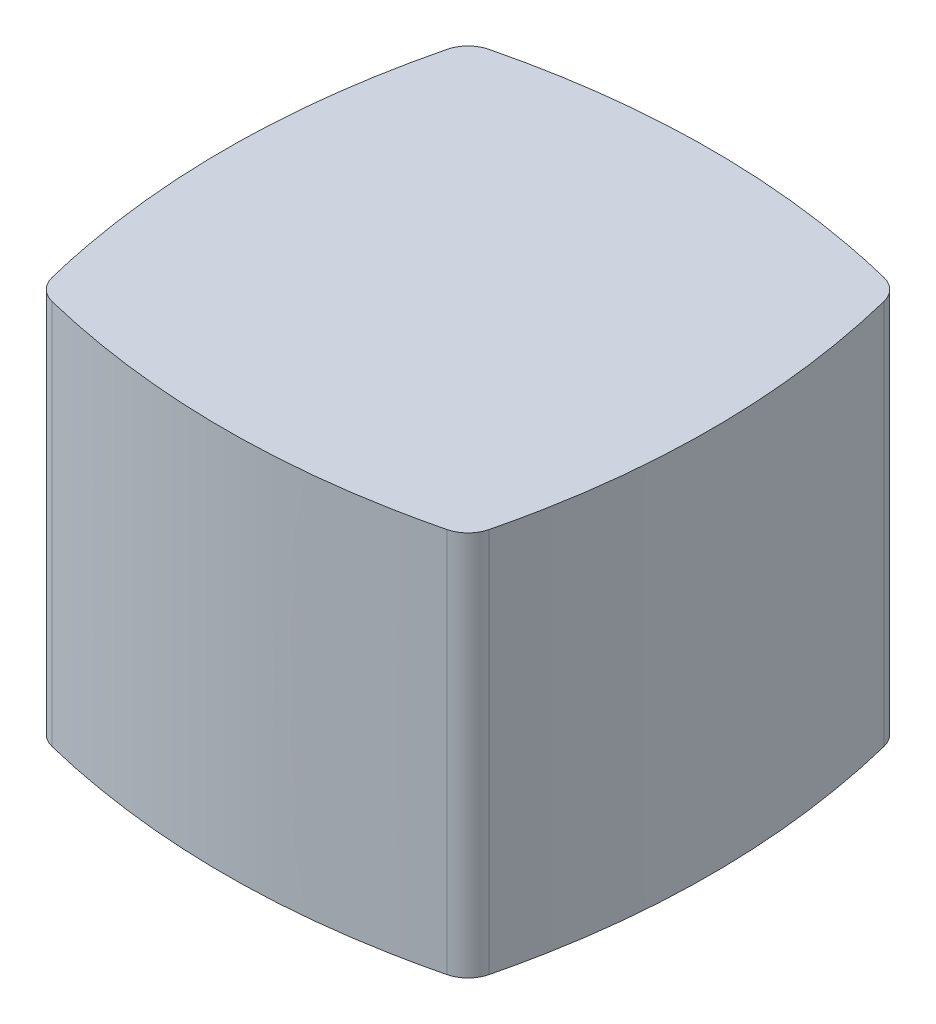
from build123d import *

# Parameters (mm, degrees)
BOSS_EXTRUDE1_DEPTH      = 42.8625
FILLET1_R                = 3.175
SHELL1_T                 = -2.54
SHELL1_THICKNESS_2_DEPTH = 22.86


with BuildPart() as part:
    # Sketch1 → Boss-Extrude1 (new body)
    with BuildSketch(Plane(origin=(0, 0, 0), x_dir=(1, 0, 0), z_dir=(0, 1, 0))):
        with BuildLine():
            Line((0, 0), (-26.9875, 0))
            add(Edge.make_bspline(
                [(-26.9875, 0), (-26.9875, -11.90625), (-23.8125, -23.8125)],
                knots=[0.5, 0.5, 0.5, 1, 1, 1], degree=2))
            add(Edge.make_bspline(
                [(-23.8125, -23.8125), (-11.90625, -26.9875), (0, -26.9875)],
                knots=[0, 0, 0, 0.5, 0.5, 0.5], degree=2))
            Line((0, -26.9875), (0, 0))
        make_face()
        with BuildLine():
            add(Edge.make_bspline(
                [(-23.8125, 23.8125), (-26.9875, 11.90625), (-26.9875, 0)],
                knots=[0, 0, 0, 0.5, 0.5, 0.5], degree=2))
            Line((-26.9875, 0), (0, 0))
            Line((0, 0), (0, 26.9875))
            add(Edge.make_bspline(
                [(-23.8125, 23.8125), (-11.90625, 26.9875), (0, 26.9875)],
                knots=[0, 0, 0, 0.5, 0.5, 0.5], degree=2))
        make_face()
        with BuildLine():
            Line((0, 26.9875), (0, 0))
            Line((0, 0), (26.9875, 0))
            add(Edge.make_bspline(
                [(23.8125, 23.8125), (26.9875, 11.90625), (26.9875, 0)],
                knots=[0, 0, 0, 0.5, 0.5, 0.5], degree=2))
            add(Edge.make_bspline(
                [(0, 26.9875), (11.90625, 26.9875), (23.8125, 23.8125)],
                knots=[0.5, 0.5, 0.5, 1, 1, 1], degree=2))
        make_face()
        with BuildLine():
            Line((26.9875, 0), (0, 0))
            Line((0, 0), (0, -26.9875))
            add(Edge.make_bspline(
                [(0, -26.9875), (11.90625, -26.9875), (23.8125, -23.8125)],
                knots=[0.5, 0.5, 0.5, 1, 1, 1], degree=2))
            add(Edge.make_bspline(
                [(26.9875, 0), (26.9875, -11.90625), (23.8125, -23.8125)],
                knots=[0.5, 0.5, 0.5, 1, 1, 1], degree=2))
        make_face()
    extrude(amount=BOSS_EXTRUDE1_DEPTH)

    # Fillet1
    fillet1_edges = [part.edges().sort_by_distance(p)[0] for p in [
        (-23.8125, 21.43125, -23.8125),
        (23.8125, 21.43125, -23.8125),
        (-23.8125, 21.43125, 23.8125),
        (23.8125, 21.43125, 23.8125),
    ]]
    fillet(fillet1_edges, radius=FILLET1_R)

    # Shell1
    shell1_openings = [part.faces().sort_by_distance(p)[0] for p in [
        (0, 0, 0),
    ]]
    offset(amount=SHELL1_T, openings=shell1_openings, kind=Kind.INTERSECTION)

    # Shell1 thickness 2 face (on inner face of the shell) → Shell1 thickness 2 (add)
    with BuildSketch(Plane.ZX.offset(40.3225)):
        with BuildLine():
            add(Edge.make_bspline(
                [(0, 24.4475), (-1.071869465, 24.4475), (-2.143739556, 24.43094642), (-3.215267754, 24.397839525), (-4.286115818, 24.348222087), (-6.421610358, 24.216394318), (-7.486265887, 24.134311515), (-8.54958659, 24.036015719), (-9.611254694, 23.921630019), (-11.743539395, 23.659419619), (-12.814109125, 23.511205126), (-13.88235706, 23.3468401), (-14.947985708, 23.166525864), (-17.086124997, 22.772130343), (-18.158566925, 22.557671393), (-19.22775412, 22.327362372), (-20.293423551, 22.08147565), (-21.35533565, 21.820305652)],
                knots=[0, 0, 0, 0, 0, 0, 0.248477459, 0.248477459, 0.248477459, 0.248477459, 0.495985618, 0.495985618, 0.495985618, 0.495985618, 0.74649861, 0.74649861, 0.74649861, 0.74649861, 1, 1, 1, 1, 1, 1], degree=5))
            add(Edge.make_bspline(
                [(21.35533565, 21.820305652), (20.289203718, 22.082513489), (19.219284528, 22.329316344), (18.145820526, 22.560416266), (17.069077982, 22.775537715), (14.930844986, 23.169424637), (13.869469996, 23.348822158), (12.805499117, 23.51239687), (11.739226346, 23.659950002), (9.607010403, 23.922151946), (8.541082283, 24.03693173), (7.47348954, 24.135491809), (6.404553827, 24.217707768), (4.269027068, 24.349012308), (3.202443079, 24.398234977), (2.135187053, 24.431078239), (1.067593219, 24.4475), (0, 24.4475)],
                knots=[0, 0, 0, 0, 0, 0, 0.254508755, 0.254508755, 0.254508755, 0.254508755, 0.504014382, 0.504014382, 0.504014382, 0.504014382, 0.752513847, 0.752513847, 0.752513847, 0.752513847, 1, 1, 1, 1, 1, 1], degree=5))
            add(Edge.make_bspline(
                [(21.820305652, 21.35533565), (21.812453385, 21.387262812), (21.802393097, 21.419258118), (21.790035363, 21.451038976), (21.77536128, 21.48227591), (21.74153415, 21.543014881), (21.722381106, 21.572517054), (21.701063345, 21.600828441), (21.677752563, 21.627635172), (21.627635172, 21.677752563), (21.600828441, 21.701063345), (21.572517054, 21.722381106), (21.543014881, 21.74153415), (21.48227591, 21.77536128), (21.451038976, 21.790035363), (21.419258118, 21.802393097), (21.387262812, 21.812453385), (21.35533565, 21.820305652)],
                knots=[0, 0, 0, 0, 0, 0, 0.249998778, 0.249998778, 0.249998778, 0.249998778, 0.5, 0.5, 0.5, 0.5, 0.750001222, 0.750001222, 0.750001222, 0.750001222, 1, 1, 1, 1, 1, 1], degree=5))
            add(Edge.make_bspline(
                [(21.820305652, 21.35533565), (22.082513489, 20.289203718), (22.329316344, 19.219284528), (22.560416266, 18.145820526), (22.775537715, 17.069077982), (23.169424637, 14.930844986), (23.348822158, 13.869469996), (23.51239687, 12.805499117), (23.659950002, 11.739226346), (23.922151946, 9.607010403), (24.03693173, 8.541082283), (24.135491809, 7.47348954), (24.217707768, 6.404553827), (24.349012308, 4.269027068), (24.398234977, 3.202443079), (24.431078239, 2.135187053), (24.4475, 1.067593219), (24.4475, 0)],
                knots=[0, 0, 0, 0, 0, 0, 0.254508755, 0.254508755, 0.254508755, 0.254508755, 0.504014382, 0.504014382, 0.504014382, 0.504014382, 0.752513847, 0.752513847, 0.752513847, 0.752513847, 1, 1, 1, 1, 1, 1], degree=5))
            add(Edge.make_bspline(
                [(24.4475, 0), (24.4475, -1.071869465), (24.43094642, -2.143739556), (24.397839525, -3.215267754), (24.348222087, -4.286115818), (24.216394318, -6.421610358), (24.134311515, -7.486265887), (24.036015719, -8.54958659), (23.921630019, -9.611254694), (23.659419619, -11.743539395), (23.511205126, -12.814109125), (23.3468401, -13.88235706), (23.166525864, -14.947985708), (22.772130343, -17.086124997), (22.557671393, -18.158566925), (22.327362372, -19.22775412), (22.08147565, -20.293423551), (21.820305652, -21.35533565)],
                knots=[0, 0, 0, 0, 0, 0, 0.248477459, 0.248477459, 0.248477459, 0.248477459, 0.495985618, 0.495985618, 0.495985618, 0.495985618, 0.74649861, 0.74649861, 0.74649861, 0.74649861, 1, 1, 1, 1, 1, 1], degree=5))
            add(Edge.make_bspline(
                [(21.820305652, -21.35533565), (21.812453385, -21.387262812), (21.802393097, -21.419258118), (21.790035363, -21.451038976), (21.77536128, -21.48227591), (21.74153415, -21.543014881), (21.722381106, -21.572517054), (21.701063345, -21.600828441), (21.677752563, -21.627635172), (21.627635172, -21.677752563), (21.600828441, -21.701063345), (21.572517054, -21.722381106), (21.543014881, -21.74153415), (21.48227591, -21.77536128), (21.451038976, -21.790035363), (21.419258118, -21.802393097), (21.387262812, -21.812453385), (21.35533565, -21.820305652)],
                knots=[0, 0, 0, 0, 0, 0, 0.249998778, 0.249998778, 0.249998778, 0.249998778, 0.5, 0.5, 0.5, 0.5, 0.750001222, 0.750001222, 0.750001222, 0.750001222, 1, 1, 1, 1, 1, 1], degree=5))
            add(Edge.make_bspline(
                [(21.35533565, -21.820305652), (20.289203718, -22.082513489), (19.219284528, -22.329316344), (18.145820526, -22.560416266), (17.069077982, -22.775537715), (14.930844986, -23.169424637), (13.869469996, -23.348822158), (12.805499117, -23.51239687), (11.739226346, -23.659950002), (9.607010403, -23.922151946), (8.541082283, -24.03693173), (7.47348954, -24.135491809), (6.404553827, -24.217707768), (4.269027068, -24.349012308), (3.202443079, -24.398234977), (2.135187053, -24.431078239), (1.067593219, -24.4475), (0, -24.4475)],
                knots=[0, 0, 0, 0, 0, 0, 0.254508755, 0.254508755, 0.254508755, 0.254508755, 0.504014382, 0.504014382, 0.504014382, 0.504014382, 0.752513847, 0.752513847, 0.752513847, 0.752513847, 1, 1, 1, 1, 1, 1], degree=5))
            add(Edge.make_bspline(
                [(0, -24.4475), (-1.071869465, -24.4475), (-2.143739556, -24.43094642), (-3.215267754, -24.397839525), (-4.286115818, -24.348222087), (-6.421610358, -24.216394318), (-7.486265887, -24.134311515), (-8.54958659, -24.036015719), (-9.611254694, -23.921630019), (-11.743539395, -23.659419619), (-12.814109125, -23.511205126), (-13.88235706, -23.3468401), (-14.947985708, -23.166525864), (-17.086124997, -22.772130343), (-18.158566925, -22.557671393), (-19.22775412, -22.327362372), (-20.293423551, -22.08147565), (-21.35533565, -21.820305652)],
                knots=[0, 0, 0, 0, 0, 0, 0.248477459, 0.248477459, 0.248477459, 0.248477459, 0.495985618, 0.495985618, 0.495985618, 0.495985618, 0.74649861, 0.74649861, 0.74649861, 0.74649861, 1, 1, 1, 1, 1, 1], degree=5))
            add(Edge.make_bspline(
                [(-21.35533565, -21.820305652), (-21.387262812, -21.812453385), (-21.419258118, -21.802393097), (-21.451038976, -21.790035363), (-21.48227591, -21.77536128), (-21.543014881, -21.74153415), (-21.572517054, -21.722381106), (-21.600828441, -21.701063345), (-21.627635172, -21.677752563), (-21.677752563, -21.627635172), (-21.701063345, -21.600828441), (-21.722381106, -21.572517054), (-21.74153415, -21.543014881), (-21.77536128, -21.48227591), (-21.790035363, -21.451038976), (-21.802393097, -21.419258118), (-21.812453385, -21.387262812), (-21.820305652, -21.35533565)],
                knots=[0, 0, 0, 0, 0, 0, 0.249998778, 0.249998778, 0.249998778, 0.249998778, 0.5, 0.5, 0.5, 0.5, 0.750001222, 0.750001222, 0.750001222, 0.750001222, 1, 1, 1, 1, 1, 1], degree=5))
            add(Edge.make_bspline(
                [(-24.4475, 0), (-24.4475, -1.071869465), (-24.43094642, -2.143739556), (-24.397839525, -3.215267754), (-24.348222087, -4.286115818), (-24.216394318, -6.421610358), (-24.134311515, -7.486265887), (-24.036015719, -8.54958659), (-23.921630019, -9.611254694), (-23.659419619, -11.743539395), (-23.511205126, -12.814109125), (-23.3468401, -13.88235706), (-23.166525864, -14.947985708), (-22.772130343, -17.086124997), (-22.557671393, -18.158566925), (-22.327362372, -19.22775412), (-22.08147565, -20.293423551), (-21.820305652, -21.35533565)],
                knots=[0, 0, 0, 0, 0, 0, 0.248477459, 0.248477459, 0.248477459, 0.248477459, 0.495985618, 0.495985618, 0.495985618, 0.495985618, 0.74649861, 0.74649861, 0.74649861, 0.74649861, 1, 1, 1, 1, 1, 1], degree=5))
            add(Edge.make_bspline(
                [(-21.820305652, 21.35533565), (-22.082513489, 20.289203718), (-22.329316344, 19.219284528), (-22.560416266, 18.145820526), (-22.775537715, 17.069077982), (-23.169424637, 14.930844986), (-23.348822158, 13.869469996), (-23.51239687, 12.805499117), (-23.659950002, 11.739226346), (-23.922151946, 9.607010403), (-24.03693173, 8.541082283), (-24.135491809, 7.47348954), (-24.217707768, 6.404553827), (-24.349012308, 4.269027068), (-24.398234977, 3.202443079), (-24.431078239, 2.135187053), (-24.4475, 1.067593219), (-24.4475, 0)],
                knots=[0, 0, 0, 0, 0, 0, 0.254508755, 0.254508755, 0.254508755, 0.254508755, 0.504014382, 0.504014382, 0.504014382, 0.504014382, 0.752513847, 0.752513847, 0.752513847, 0.752513847, 1, 1, 1, 1, 1, 1], degree=5))
            add(Edge.make_bspline(
                [(-21.820305652, 21.35533565), (-21.812453385, 21.387262812), (-21.802393097, 21.419258118), (-21.790035363, 21.451038976), (-21.77536128, 21.48227591), (-21.74153415, 21.543014881), (-21.722381106, 21.572517054), (-21.701063345, 21.600828441), (-21.677752563, 21.627635172), (-21.627635172, 21.677752563), (-21.600828441, 21.701063345), (-21.572517054, 21.722381106), (-21.543014881, 21.74153415), (-21.48227591, 21.77536128), (-21.451038976, 21.790035363), (-21.419258118, 21.802393097), (-21.387262812, 21.812453385), (-21.35533565, 21.820305652)],
                knots=[0, 0, 0, 0, 0, 0, 0.249998778, 0.249998778, 0.249998778, 0.249998778, 0.5, 0.5, 0.5, 0.5, 0.750001222, 0.750001222, 0.750001222, 0.750001222, 1, 1, 1, 1, 1, 1], degree=5))
        make_face()
    extrude(amount=-SHELL1_THICKNESS_2_DEPTH)


solid = part.part
